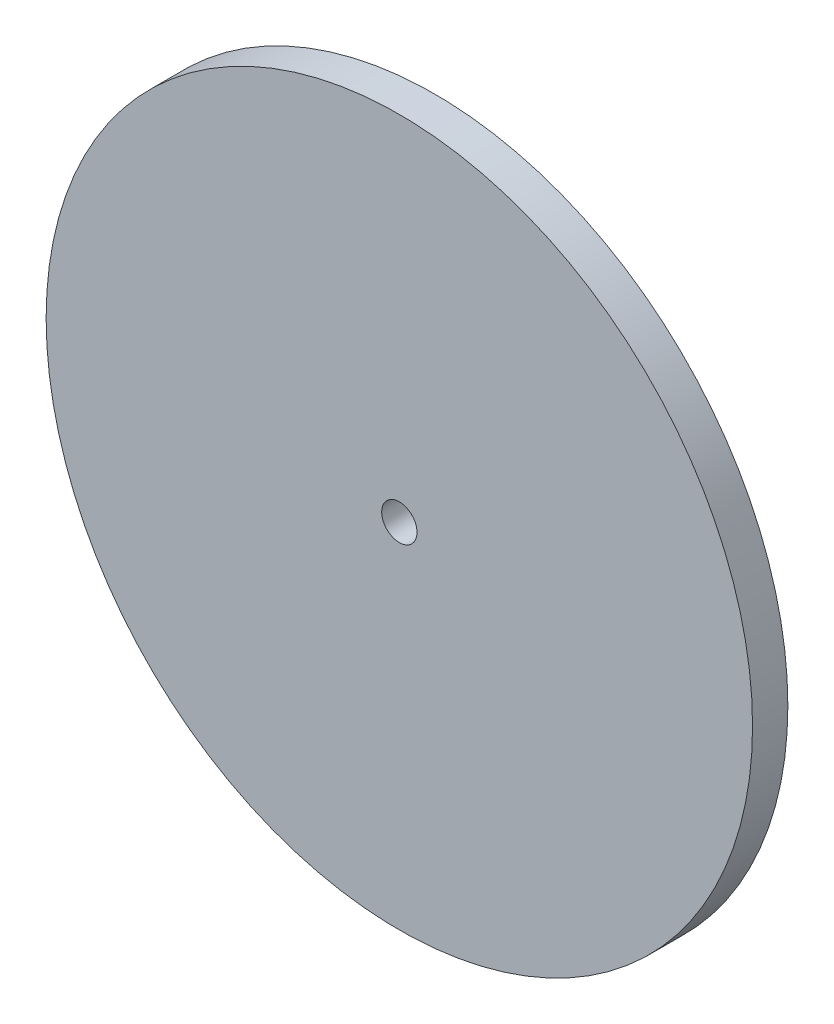
from build123d import *

# Parameters (mm, degrees)
SKETCH1_R           = 500
BOSS_EXTRUDE1_DEPTH = 25
CUT_EXTRUDE1_REACH  = 710.872
SKETCH2_R           = 25


with BuildPart() as part:
    # Sketch1 → Boss-Extrude1 (new, symmetric)
    with BuildSketch(Plane.XY):
        Circle(SKETCH1_R)
    extrude(amount=BOSS_EXTRUDE1_DEPTH, both=True)

    # Sketch2 → Cut-Extrude1 (cut, up to next)
    with BuildSketch(Plane.XY.offset(25), mode=Mode.PRIVATE) as cut_extrude1_sk1:
        Circle(SKETCH2_R)
    cut_extrude1_tool1 = extrude(cut_extrude1_sk1.sketch, amount=-CUT_EXTRUDE1_REACH, mode=Mode.PRIVATE) & part.part
    add(cut_extrude1_tool1.solids().sort_by_distance((0, 0, 25))[0], mode=Mode.SUBTRACT)


solid = part.part
